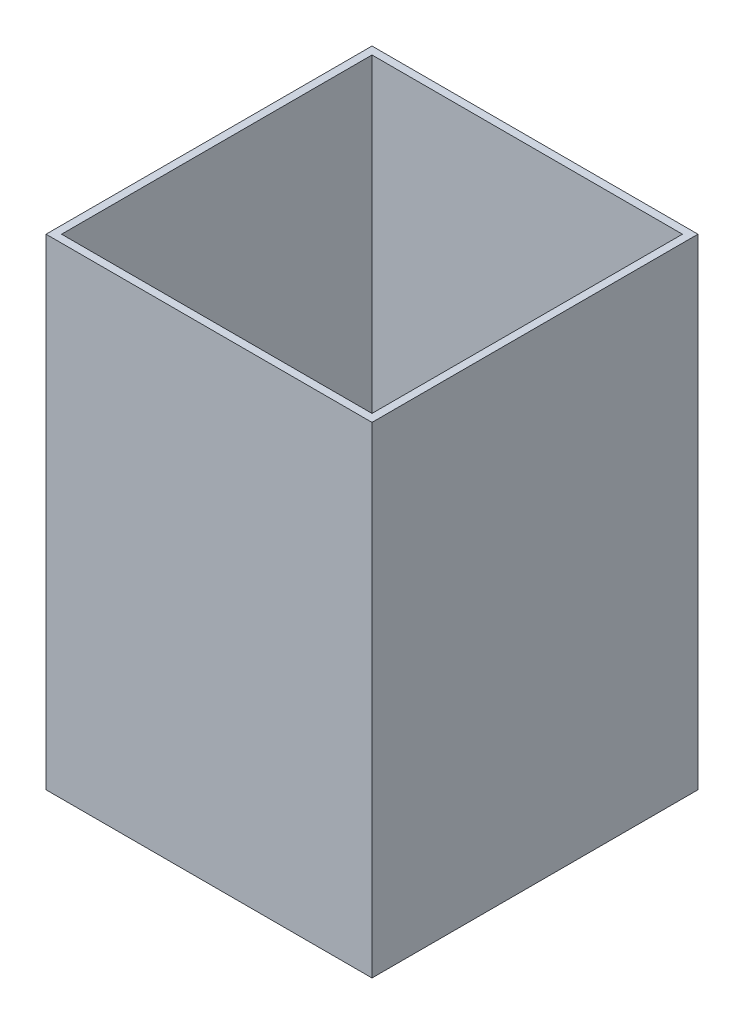
from build123d import *

# Parameters (mm, degrees)
SKETCH_1_W          = 210
SKETCH_1_H          = 210
EXTRUDE_1_DEPTH     = 310
CUT_EXTRUDE_START   = 310
SKETCH_2_W          = 200
SKETCH_2_H          = 200
CUT_EXTRUDE_1_DEPTH = 300


with BuildPart() as part:
    # 草图1 → 凸台-拉伸1 (new body)
    with BuildSketch(Plane(origin=(0, 0, 0), x_dir=(1, 0, 0), z_dir=(0, 1, 0))):
        Rectangle(SKETCH_1_W, SKETCH_1_H)
    extrude(amount=EXTRUDE_1_DEPTH)

    # 草图2 → 切除-拉伸1 (cut)
    with BuildSketch(Plane(origin=(0, 0, 0), x_dir=(1, 0, 0), z_dir=(0, 1, 0)).offset(CUT_EXTRUDE_START)):
        Rectangle(SKETCH_2_W, SKETCH_2_H)
    extrude(amount=-CUT_EXTRUDE_1_DEPTH, mode=Mode.SUBTRACT)


solid = part.part
